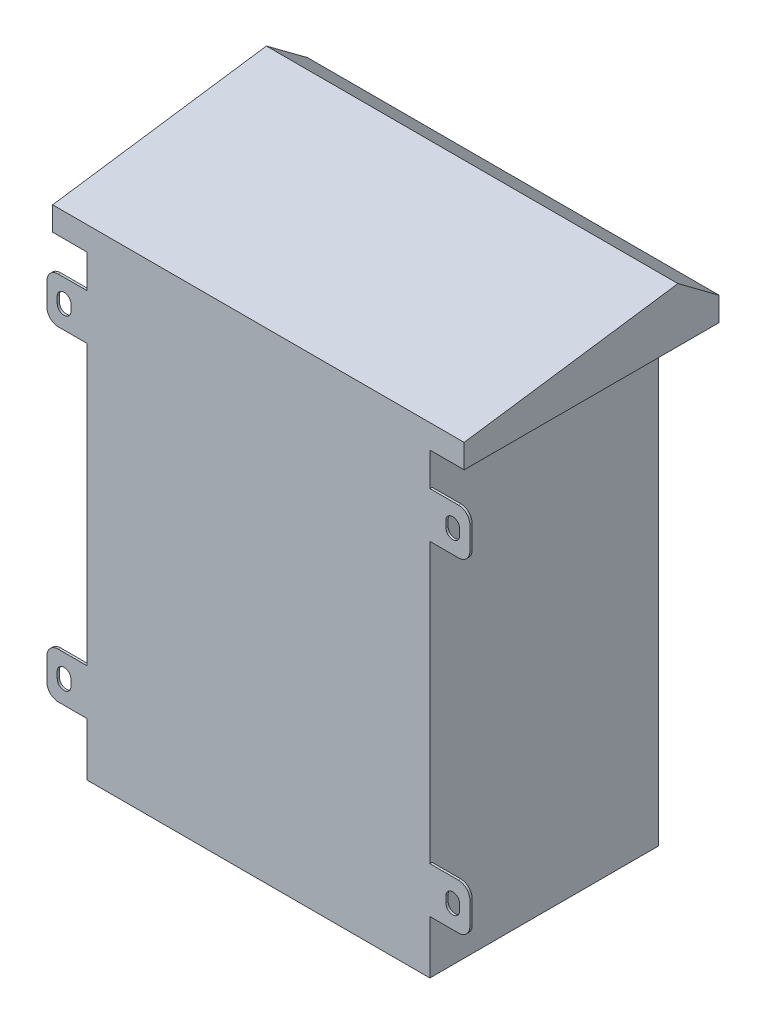
from build123d import *

# Parameters (mm, degrees)
SKETCH_2_W          = 300
SKETCH_2_H          = 400
EXTRUDE_1_DEPTH     = 200
SHELL_1_T           = -2
SKETCH_7_W          = 296
SKETCH_7_H          = 396
EXTRUDE_2_DEPTH     = 2
CUT_EXTRUDE_1_REACH = 322.156
SKETCH_9_W          = 240
SKETCH_9_H          = 340
SKETCH_11_W         = 244
SKETCH_11_H         = 344
SKETCH_11_W_2       = 240
SKETCH_11_H_2       = 340
EXTRUDE_2_2_DEPTH   = 20
SKETCH_18_W         = 240
SKETCH_18_H         = 340
EXTRUDE_6_DEPTH     = 15
SHELL_3_T           = -2
EXTRUDE_8_DEPTH     = 180
SKETCH_24_R         = 20
SKETCH_24_R_2       = 2
CUT_EXTRUDE_2_DEPTH = 2
SKETCH_25_W         = 240
SKETCH_25_H         = 340
SKETCH_25_W_2       = 220
SKETCH_25_H_2       = 320
EXTRUDE_9_DEPTH     = 2
EXTRUDE_10_DEPTH    = 2


with BuildPart() as part:
    # 草图2 → 凸台-拉伸1 (new body)
    with BuildSketch(Plane.XY):
        Rectangle(SKETCH_2_W, SKETCH_2_H)
    extrude(amount=EXTRUDE_1_DEPTH)

    # 抽壳1
    shell_1_openings = [part.faces().sort_by_distance(p)[0] for p in [
        (0, 0, 0),
    ]]
    offset(amount=SHELL_1_T, openings=shell_1_openings, kind=Kind.INTERSECTION)

    # 草图7 → Extrude 2 (add)
    with BuildSketch(Plane(origin=(0, 0, 0), x_dir=(-1, 0, 0), z_dir=(0, 0, -1))):
        Rectangle(SKETCH_7_W, SKETCH_7_H)
    extrude(amount=-EXTRUDE_2_DEPTH)

    # 草图9 → 切除-拉伸1 (cut, up to next)
    with BuildSketch(Plane(origin=(0, 0, 0), x_dir=(-1, 0, 0), z_dir=(0, 0, -1)), mode=Mode.PRIVATE) as cut_extrude_1_sk1:
        Rectangle(SKETCH_9_W, SKETCH_9_H)
    cut_extrude_1_tool1 = extrude(cut_extrude_1_sk1.sketch, amount=-CUT_EXTRUDE_1_REACH, mode=Mode.PRIVATE) & part.part
    add(cut_extrude_1_tool1.solids().sort_by_distance((0, 0, 0))[0], mode=Mode.SUBTRACT)

    # 草图11 → Extrude 2 2 (add)
    with BuildSketch(Plane(origin=(0, 0, 0), x_dir=(-1, 0, 0), z_dir=(0, 0, -1))):
        Rectangle(SKETCH_11_W, SKETCH_11_H)
        Rectangle(SKETCH_11_W_2, SKETCH_11_H_2, mode=Mode.SUBTRACT)
    extrude(amount=-EXTRUDE_2_2_DEPTH)

    # 草图23 → 凸台-拉伸8 (add, symmetric)
    with BuildSketch(Plane(origin=(0, 0, 0), x_dir=(0, 0, -1), z_dir=(1, 0, 0))):
        Polygon((-13, 247.6), (-200, 220.8), (-200, 200), (23, 200), (23, 220.8), align=None)
    extrude(amount=EXTRUDE_8_DEPTH, both=True)

    # 草图24 → 切除-拉伸2 (cut)
    with BuildSketch(Plane.XZ.offset(200)):
        with Locations(Location((0, 156.1, 0), (0, 0, 270))):
            Circle(SKETCH_24_R)
        with Locations(Location((32.4, 141.1, 0), (0, 0, 270))):
            Circle(SKETCH_24_R_2)
        with Locations(Location((-32.4, 141.1, 0), (0, 0, 90))):
            Circle(SKETCH_24_R_2)
    extrude(amount=-CUT_EXTRUDE_2_DEPTH, mode=Mode.SUBTRACT)

    # 草图25 → 凸台-拉伸9 (add)
    with BuildSketch(Plane.XY.offset(20)):
        Rectangle(SKETCH_25_W, SKETCH_25_H)
        Rectangle(SKETCH_25_W_2, SKETCH_25_H_2, mode=Mode.SUBTRACT)
    extrude(amount=-EXTRUDE_9_DEPTH)

    # 草图26 → 凸台-拉伸10 (add)
    # profile 1 of 4: a face of its own
    with BuildSketch(Plane.XY.offset(200)):
        with BuildLine():
            Line((150, -113.4), (150, -153.4))
            Line((150, -153.4), (175, -153.4))
            ThreePointArc((175, -153.4), (182.071067812, -150.471067812), (185, -143.4))
            Line((185, -143.4), (185, -123.4))
            ThreePointArc((185, -123.4), (182.071067812, -116.328932188), (175, -113.4))
            Line((175, -113.4), (150, -113.4))
        make_face()
        with BuildLine():
            Line((176, -136.15), (176, -130.65))
            ThreePointArc((176, -130.65), (170, -124.65), (164, -130.65))
            Line((164, -130.65), (164, -136.15))
            ThreePointArc((164, -136.15), (170, -142.15), (176, -136.15))
        make_face(mode=Mode.SUBTRACT)
    # profile 2 of 4: a face of its own
    with BuildSketch(Plane.XY.offset(200)):
        with BuildLine():
            Line((150, 130.8), (175, 130.8))
            ThreePointArc((175, 130.8), (182.071067812, 133.728932188), (185, 140.8))
            Line((185, 140.8), (185, 160.8))
            ThreePointArc((185, 160.8), (182.071067812, 167.871067812), (175, 170.8))
            Line((175, 170.8), (150, 170.8))
            Line((150, 170.8), (150, 130.8))
        make_face()
        with BuildLine():
            Line((164, 148.05), (164, 153.55))
            ThreePointArc((164, 153.55), (170, 159.55), (176, 153.55))
            Line((176, 153.55), (176, 148.05))
            ThreePointArc((176, 148.05), (170, 142.05), (164, 148.05))
        make_face(mode=Mode.SUBTRACT)
    # profile 3 of 4: a face of its own
    with BuildSketch(Plane.XY.offset(200)):
        with BuildLine():
            Line((-185, 140.8), (-185, 160.8))
            ThreePointArc((-185, 160.8), (-182.071067812, 167.871067812), (-175, 170.8))
            Line((-175, 170.8), (-150, 170.8))
            Line((-150, 170.8), (-150, 130.8))
            Line((-150, 130.8), (-175, 130.8))
            ThreePointArc((-175, 130.8), (-182.071067812, 133.728932188), (-185, 140.8))
        make_face()
        with BuildLine():
            Line((-176, 148.05), (-176, 153.55))
            ThreePointArc((-176, 153.55), (-170, 159.55), (-164, 153.55))
            Line((-164, 153.55), (-164, 148.05))
            ThreePointArc((-164, 148.05), (-170, 142.05), (-176, 148.05))
        make_face(mode=Mode.SUBTRACT)
    # profile 4 of 4: a face of its own
    with BuildSketch(Plane.XY.offset(200)):
        with BuildLine():
            Line((-185, -143.4), (-185, -123.4))
            ThreePointArc((-185, -123.4), (-182.071067812, -116.328932188), (-175, -113.4))
            Line((-175, -113.4), (-150, -113.4))
            Line((-150, -113.4), (-150, -153.4))
            Line((-150, -153.4), (-175, -153.4))
            ThreePointArc((-175, -153.4), (-182.071067812, -150.471067812), (-185, -143.4))
        make_face()
        with BuildLine():
            Line((-164, -136.15), (-164, -130.65))
            ThreePointArc((-164, -130.65), (-170, -124.65), (-176, -130.65))
            Line((-176, -130.65), (-176, -136.15))
            ThreePointArc((-176, -136.15), (-170, -142.15), (-164, -136.15))
        make_face(mode=Mode.SUBTRACT)
    extrude(amount=-EXTRUDE_10_DEPTH)


with BuildPart() as body_2:
    # 草图18 → 凸台-拉伸6 (new body)
    with BuildSketch(Plane(origin=(0, 0, 198), x_dir=(-1, 0, 0), z_dir=(0, 0, -1))):
        with Locations((500, 0)):
            Rectangle(SKETCH_18_W, SKETCH_18_H)
    extrude(amount=EXTRUDE_6_DEPTH)

    # 抽壳3
    shell_3_openings = [body_2.faces().sort_by_distance(p)[0] for p in [
        (-500, 0, 198),
    ]]
    offset(amount=SHELL_3_T, openings=shell_3_openings, kind=Kind.INTERSECTION)


with BuildPart() as body_2_1:
    # Move Body 2: moved
    add(body_2.part.moved(Location((500, 0, 0))))


solid = Compound([part.part, body_2_1.part])
